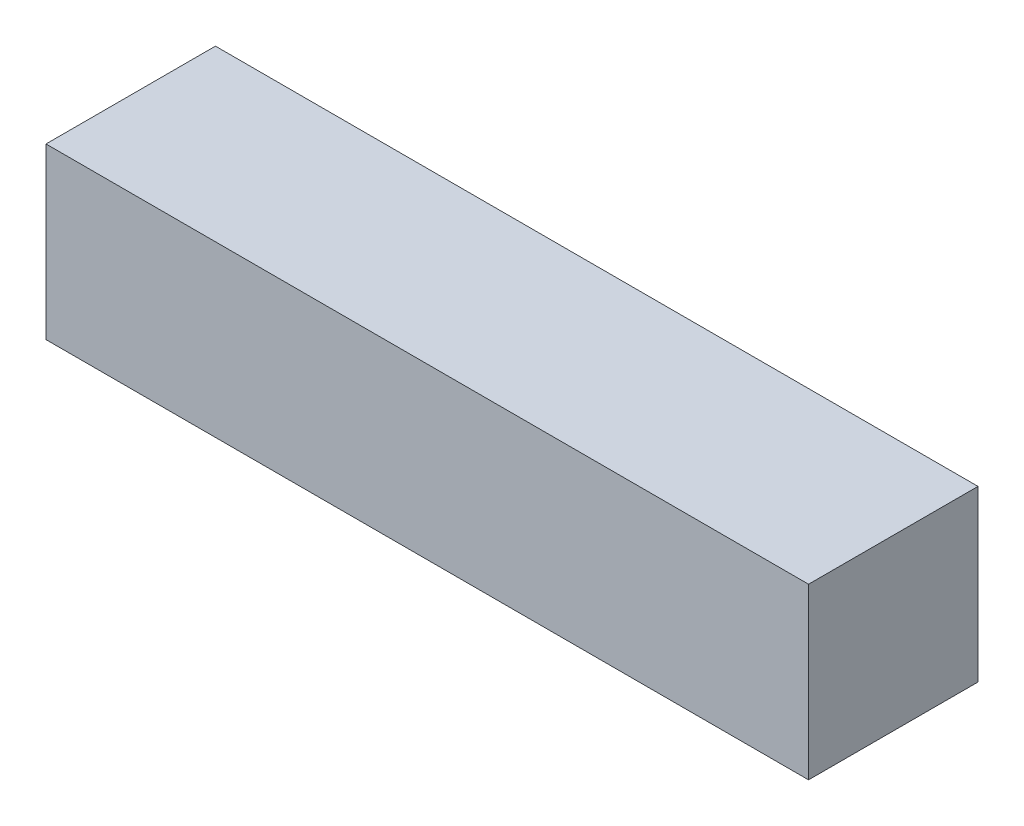
from build123d import *

# Parameters (mm, degrees)
ESQUISSE1_W        = 270
ESQUISSE1_H        = 60
BOSS_EXTRU_1_DEPTH = 60


with BuildPart() as part:
    # Esquisse1 → Boss.-Extru.1 (new body)
    with BuildSketch(Plane.XY):
        with Locations((135, 30)):
            Rectangle(ESQUISSE1_W, ESQUISSE1_H)
    extrude(amount=BOSS_EXTRU_1_DEPTH)


solid = part.part
